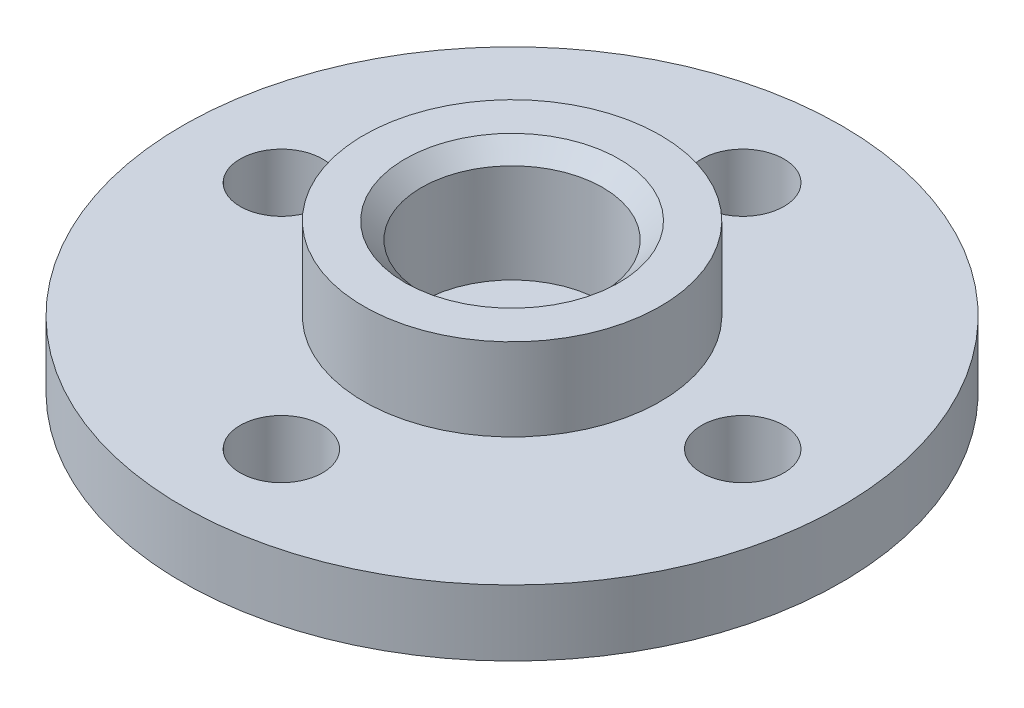
from build123d import *

# Parameters (mm, degrees)
HOLE_WIZARD_M3_1_D = 2.5
CHAMFER_1_SIZE     = 0.5


with BuildPart() as part:
    # 草图1 → 旋转1 (revolve)
    with BuildSketch(Plane(origin=(0, 0, 0), x_dir=(0, 0, -1), z_dir=(1, 0, 0))):
        Polygon((2.75, 0), (10, 0), (10, 2), (4.5, 2), (4.5, 4.5), (2.75, 4.5), (2.75, 1), (1, 1), (1, 0), align=None)
    revolve(axis=Axis((0, 0, 0), (0, 1, 0)))

    # M3 螺纹孔的螺纹孔钻头1 (through all)
    with Locations(Plane(origin=(0, 2, 0), x_dir=(1, 0, 0), z_dir=(0, 1, 0))):
        with Locations((0, -7), (0, 7), (-7, 0), (7, 0)):
            Hole(HOLE_WIZARD_M3_1_D / 2)

    # 倒角1
    chamfer_1_edges = [part.edges().sort_by_distance(p)[0] for p in [
        (0, 4.5, 2.75),
    ]]
    chamfer(chamfer_1_edges, length=CHAMFER_1_SIZE)


solid = part.part
